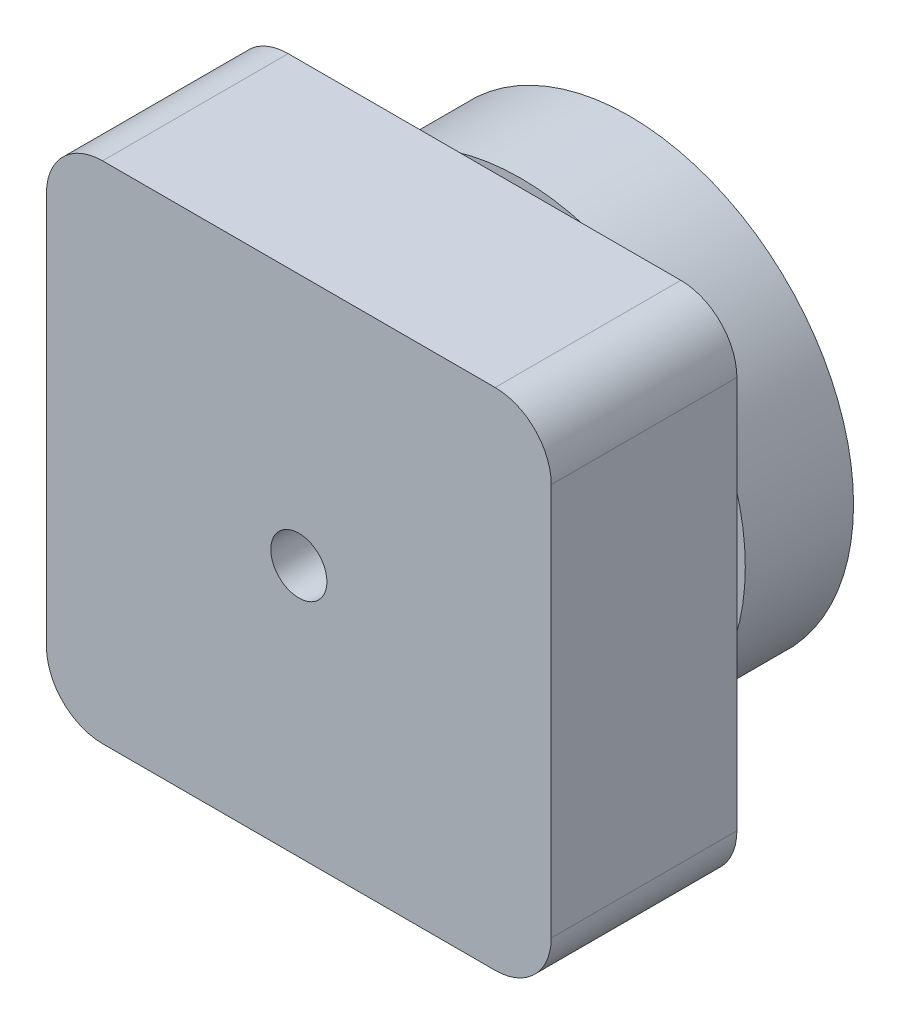
from build123d import *

# Parameters (mm, degrees)
SKETCH1_W                               = 40
SKETCH1_H                               = 19.3
SKETCH2_R                               = 20
BOSS_EXTRUDE1_DEPTH                     = 6.5
CBORE_FOR_M8_HEX_HEAD_BOLT1_D           = 10
CBORE_FOR_M8_HEX_HEAD_BOLT1_CBORE_D     = 20
CBORE_FOR_M8_HEX_HEAD_BOLT1_CBORE_DEPTH = 4
F_5_0_5_DIAMETER_HOLE1_D                = 5
F_5_0_5_DIAMETER_HOLE1_DEPTH            = 8
SKETCH7_W                               = 90
SKETCH7_H                               = 90
SKETCH7_R                               = 5
BOSS_EXTRUDE2_DEPTH                     = 33.1
FILLET1_R                               = 10


with BuildPart() as part:
    # Sketch1 → Revolve1 (revolve)
    with BuildSketch(Plane.XZ, mode=Mode.PRIVATE) as revolve1_sk:
        with Locations((20, -16.15)):
            Rectangle(SKETCH1_W, SKETCH1_H)
    revolve(revolve1_sk.sketch.rotate(Axis((0, 0, -6.5), (0, 0, -1)), 270), axis=Axis((0, 0, -6.5), (0, 0, -1)))

    # Sketch2 → Boss-Extrude1 (add)
    with BuildSketch(Plane.XY.offset(-6.5)):
        Circle(SKETCH2_R)
    extrude(amount=BOSS_EXTRUDE1_DEPTH)

    # CBORE for M8 Hex Head Bolt1 (through all)
    with Locations(Plane.XY):
        with Locations((0, 0)):
            CounterBoreHole(CBORE_FOR_M8_HEX_HEAD_BOLT1_D / 2, CBORE_FOR_M8_HEX_HEAD_BOLT1_CBORE_D / 2, CBORE_FOR_M8_HEX_HEAD_BOLT1_CBORE_DEPTH)

    # Ø5.0 (5) Diameter Hole1
    with Locations(Plane.XY):
        with Locations((-15.75, 0), (-11.136931804, 11.136931804), (-11.136931804, -11.136931804), (11.136931804, -11.136931804), (11.136931804, 11.136931804)):
            Hole(F_5_0_5_DIAMETER_HOLE1_D / 2, depth=F_5_0_5_DIAMETER_HOLE1_DEPTH)

    # Sketch7 → Boss-Extrude2 (add)
    with BuildSketch(Plane.XY):
        Rectangle(SKETCH7_W, SKETCH7_H)
        Circle(SKETCH7_R, mode=Mode.SUBTRACT)
    extrude(amount=BOSS_EXTRUDE2_DEPTH)

    # Fillet1
    fillet1_edges = [part.edges().sort_by_distance(p)[0] for p in [
        (45, -45, 16.55),
        (45, 45, 16.55),
        (-45, 45, 16.55),
        (-45, -45, 16.55),
    ]]
    fillet(fillet1_edges, radius=FILLET1_R)


solid = part.part
